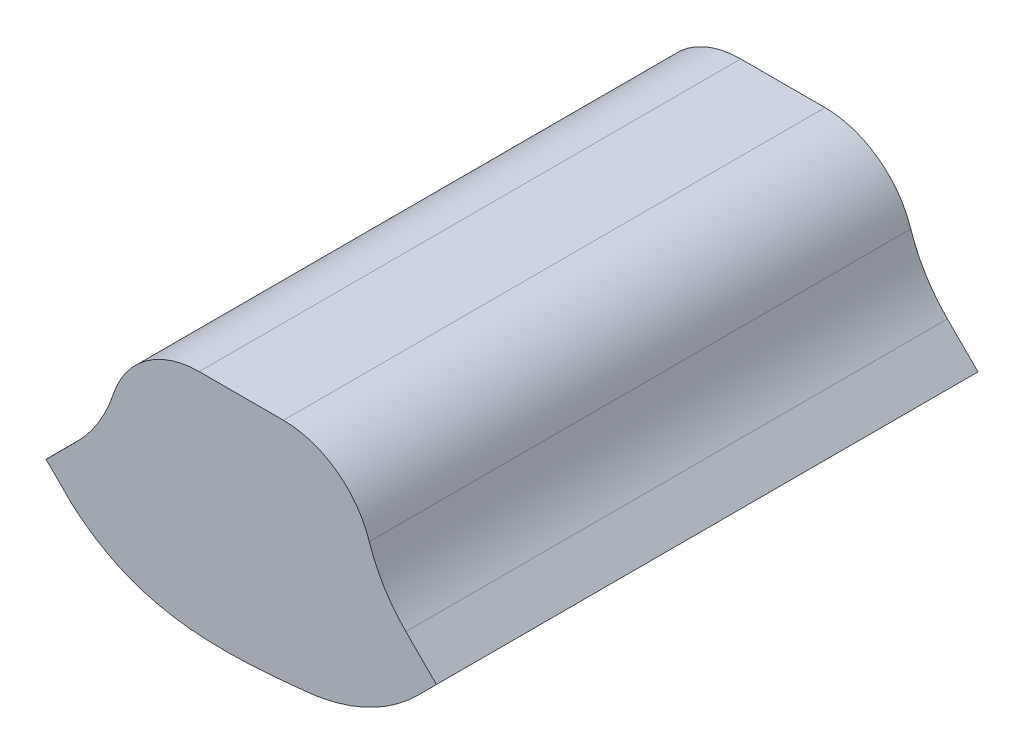
from build123d import *

# Parameters (mm, degrees)
BOSS_EXTRUDE1_DEPTH = 18


with BuildPart() as part:
    # Sketch1 → Boss-Extrude1 (new body)
    with BuildSketch(Plane.XY):
        with BuildLine():
            Line((-7.163105934, -7.293646663), (-6.547062338, -6.677603067))
            Line((-6.547062338, -6.677603067), (-6.612332703, -6.612332703))
            Line((-6.612332703, -6.612332703), (-7.563291756, -5.661373649))
            ThreePointArc((-7.563291756, -5.661373649), (-8.288491154, -4.742354928), (-8.78011552, -3.679897843))
            ThreePointArc((-8.78011552, -3.679897843), (-9.870465754, -2.18361858), (-11.631530122, -1.612332703))
            Line((-11.631530122, -1.612332703), (-14.432396648, -1.612332703))
            ThreePointArc((-14.432396648, -1.612332703), (-16.193461017, -2.18361858), (-17.28381125, -3.679897843))
            ThreePointArc((-17.28381125, -3.679897843), (-17.775435616, -4.742354928), (-18.500635014, -5.661373649))
            Line((-18.500635014, -5.661373649), (-19.451594068, -6.612332703))
            Line((-19.451594068, -6.612332703), (-19.524780345, -6.680666225))
            Line((-19.524780345, -6.680666225), (-18.670477775, -7.534870352))
            add(Edge.make_bspline(
                [(-18.670477775, -7.534870352), (-18.125131144, -8.012979969), (-17.277228248, -8.540037204), (-16.066456083, -8.958058574), (-14.806247878, -9.200473351), (-13.120861063, -9.255335571), (-11.668367706, -9.128182371), (-10.874120868, -9.043245859), (-10.794454533, -9.034648972)],
                knots=[0, 0, 0, 0, 0.231047832, 0.35138283, 0.481745746, 0.716877708, 0.971604001, 1, 1, 1, 1], degree=3, weights=[1, 1, 1, 1, 1, 1, 1, 1, 1]))
            add(Edge.make_bspline(
                [(-7.163105934, -7.293646663), (-7.528267353, -7.658808082), (-7.948111458, -7.955995317), (-8.369394277, -8.254200947), (-8.833411811, -8.476523795), (-9.296011092, -8.69816712), (-9.792074347, -8.839471582), (-10.28381467, -8.979544649), (-10.794454533, -9.034648972)],
                knots=[0, 0, 0, 0.25, 0.25, 0.5, 0.5, 0.75, 0.75, 1, 1, 1], degree=2))
        make_face()
    extrude(amount=-BOSS_EXTRUDE1_DEPTH)


solid = part.part
